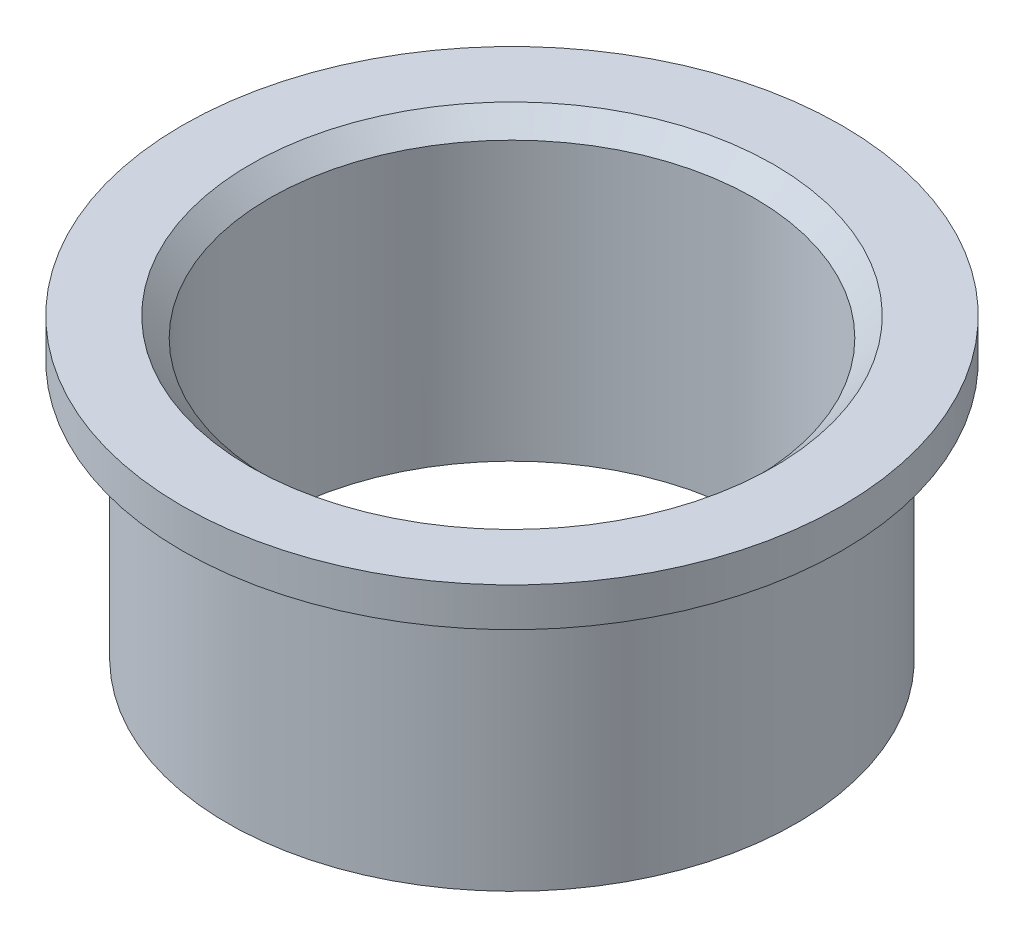
from build123d import *

# Parameters (mm, degrees)
CHAMFER1_SIZE = 3


with BuildPart() as part:
    # Sketch1 → Revolve1 (revolve)
    with BuildSketch(Plane.XY, mode=Mode.PRIVATE) as revolve1_sk:
        Polygon((37.5, 0), (37.5, 46), (51, 46), (51, 40), (44, 40), (44, 0), align=None)
    revolve(revolve1_sk.sketch.rotate(Axis((0, 0, 0), (0, 1, 0)), 90), axis=Axis((0, 0, 0), (0, 1, 0)))

    # Chamfer1
    chamfer1_edges = [part.edges().sort_by_distance(p)[0] for p in [
        (0, 46, 37.5),
    ]]
    chamfer(chamfer1_edges, length=CHAMFER1_SIZE)


solid = part.part
